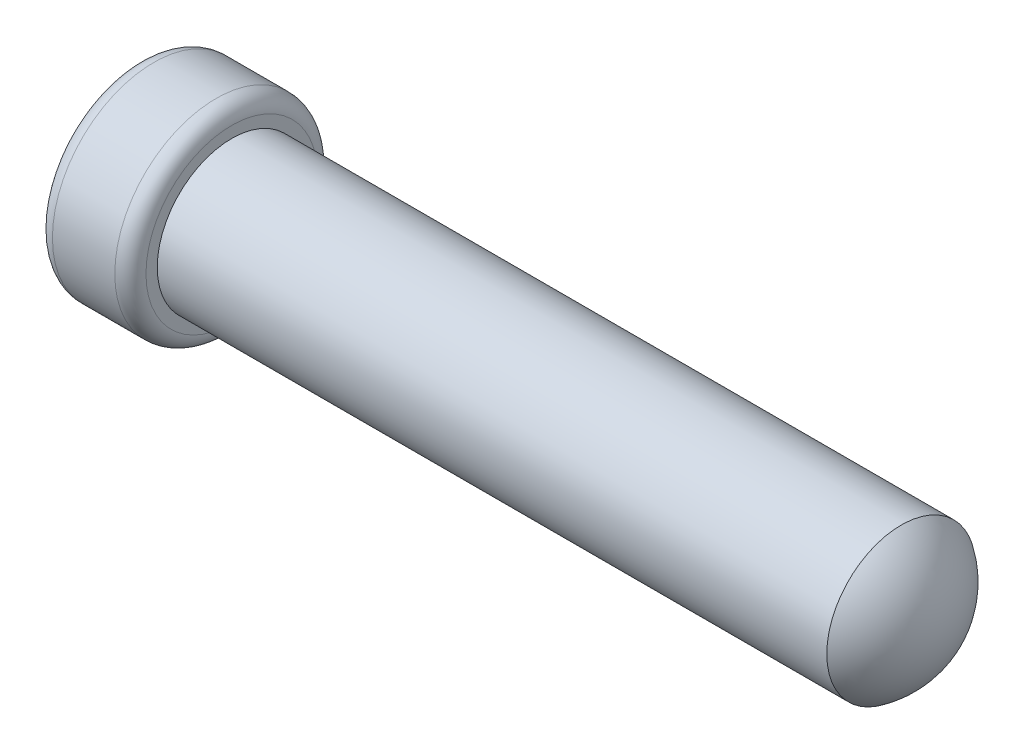
from build123d import *


with BuildPart() as part:
    # Sketch1 → RevolutionAngle1 (revolve)
    with BuildSketch(Plane.XY, mode=Mode.PRIVATE) as revolutionangle1_sk:
        with BuildLine():
            Line((0, 0), (2.6162, 0))
            ThreePointArc((2.6162, 0), (2.581474496, 0.137373984), (2.486546783, 0.24257))
            Line((2.486546783, 0.24257), (0.3048, 0.24257))
            Line((0.3048, 0.24257), (0.3048, 0.2794))
            ThreePointArc((0.3048, 0.2794), (0.289921024, 0.315321024), (0.254, 0.3302))
            Line((0.254, 0.3302), (0.0508, 0.3302))
            ThreePointArc((0.0508, 0.3302), (0.014878976, 0.315321024), (0, 0.2794))
            Line((0, 0.2794), (0, 0))
        make_face()
    revolve(revolutionangle1_sk.sketch.rotate(Axis((-0.343512289, 0, 0), (1, 0, 0)), 90), axis=Axis((-0.343512289, 0, 0), (1, 0, 0)))


solid = part.part
